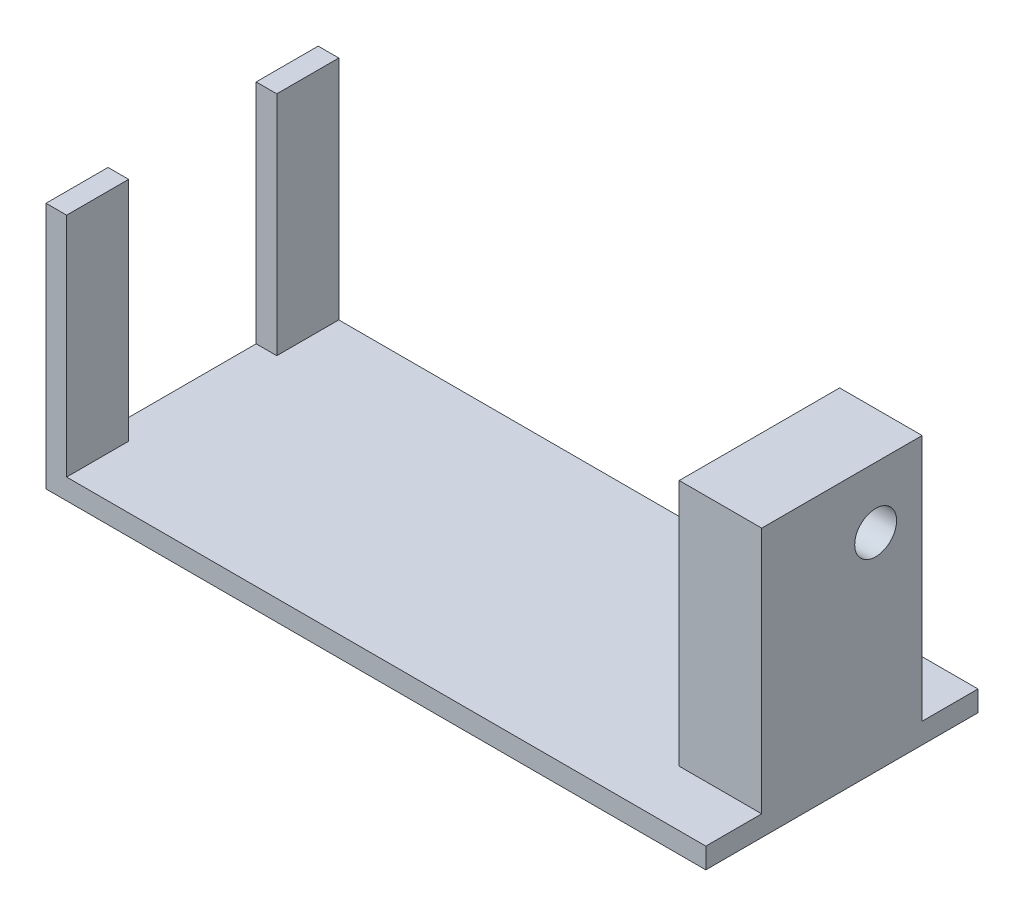
from build123d import *

# Parameters (mm, degrees)
SKETCH2_W             = 3.175
SKETCH2_H             = 9.5504
BOSS_EXTRUDE5_DEPTH   = 38.1
BOSS_EXTRUDE5_2_DEPTH = 38.1
BOSS_EXTRUDE6_DEPTH   = 3.175
SKETCH3_W             = 12.7
SKETCH3_H             = 24.700794202
BOSS_EXTRUDE7_DEPTH   = 38.1
SKETCH4_R             = 3.2258
CUT_EXTRUDE1_DEPTH    = 30.48


with BuildPart() as part:
    # Sketch2 → Boss-Extrude5 (new body)
    with BuildSketch(Plane(origin=(0, 0, 0), x_dir=(1, 0, 0), z_dir=(0, 1, 0))):
        with Locations((1.5875, 37.1348)):
            Rectangle(SKETCH2_W, SKETCH2_H)
    extrude(amount=BOSS_EXTRUDE5_DEPTH)



with BuildPart() as body_2:
    # Sketch2 → Boss-Extrude5 2 (new body)
    with BuildSketch(Plane(origin=(0, 0, 0), x_dir=(1, 0, 0), z_dir=(0, 1, 0))):
        with Locations((1.5875, 4.7752)):
            Rectangle(SKETCH2_W, SKETCH2_H)
    extrude(amount=BOSS_EXTRUDE5_2_DEPTH)


with BuildPart() as part_1:
    add(part.part)

    add(body_2.part)  # Boss-Extrude6 merges body 2
    # Sketch2<11> → Boss-Extrude6 (add)
    with BuildSketch(Plane(origin=(0, 0, 0), x_dir=(1, 0, 0), z_dir=(0, 1, 0))):
        Polygon((0, 32.3596), (0, 20.955), (0, 9.5504), (3.175, 9.5504), (3.175, 0), (101.6, 0), (101.6, 41.91), (3.175, 41.91), (3.175, 32.3596), align=None)
    extrude(amount=BOSS_EXTRUDE6_DEPTH)

    # Sketch3 → Boss-Extrude7 (add)
    with BuildSketch(Plane(origin=(0, 3.175, 0), x_dir=(1, 0, 0), z_dir=(0, 1, 0))):
        with Locations((95.25, 20.955)):
            Rectangle(SKETCH3_W, SKETCH3_H)
    extrude(amount=BOSS_EXTRUDE7_DEPTH)

    # Sketch4 → Cut-Extrude1 (cut)
    with BuildSketch(Plane.ZY.offset(-88.9)):
        with Locations((-26.150217101, 31.9024)):
            Circle(SKETCH4_R)
    extrude(amount=-CUT_EXTRUDE1_DEPTH, mode=Mode.SUBTRACT)


solid = part_1.part
